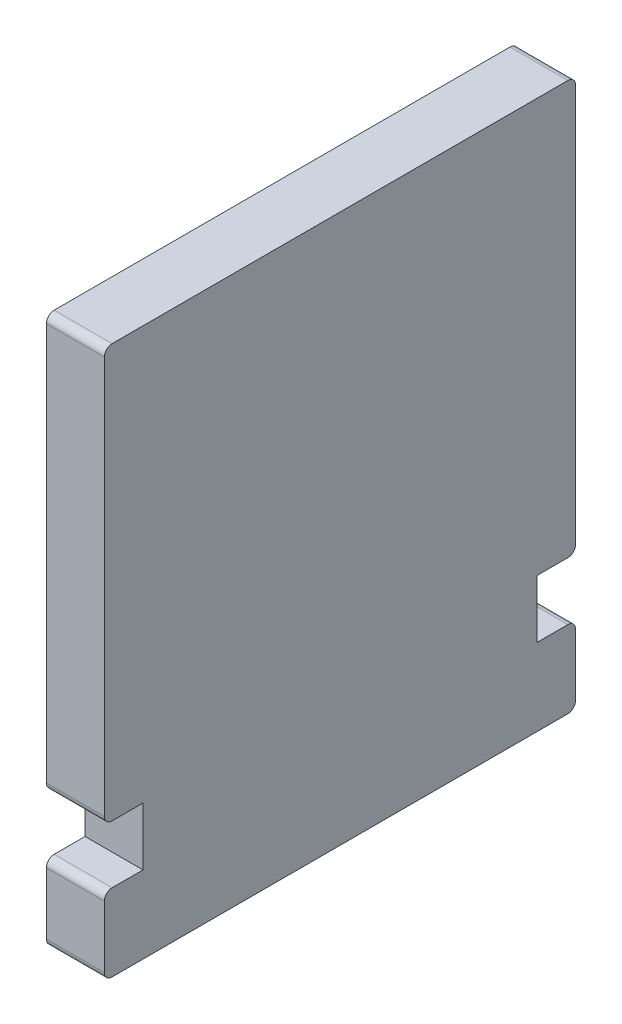
from build123d import *

# Parameters (mm, degrees)
SKETCH_1_W          = 1.5
SKETCH_1_H          = 14.2
EXTRUDE_1_DEPTH     = 12.2
CUT_EXTRUDE_2_REACH = 20.781
SKETCH_5_W          = 2.597491907
SKETCH_5_H          = 1.5
SKETCH_5_W_2        = 2.655260115
FILLET_1_R          = 0.2


with BuildPart() as part:
    # 草图1 → 凸台-拉伸1 (new body)
    with BuildSketch(Plane.XY):
        with Locations((0.75, 7.1)):
            Rectangle(SKETCH_1_W, SKETCH_1_H)
    extrude(amount=EXTRUDE_1_DEPTH)

    # 草图5 → 切除-拉伸2 (cut, up to next)
    with BuildSketch(Plane(origin=(1.5, 0, 0), x_dir=(0, 0, -1), z_dir=(1, 0, 0)), mode=Mode.PRIVATE) as cut_extrude_2_sk1:
        with Locations((-12.498745954, 2.75)):
            Rectangle(SKETCH_5_W, SKETCH_5_H)
    cut_extrude_2_tool1 = extrude(cut_extrude_2_sk1.sketch, amount=-CUT_EXTRUDE_2_REACH, mode=Mode.PRIVATE) & part.part
    # 草图5 → 切除-拉伸2 (cut, up to next)
    with BuildSketch(Plane(origin=(1.5, 0, 0), x_dir=(0, 0, -1), z_dir=(1, 0, 0)), mode=Mode.PRIVATE) as cut_extrude_2_sk2:
        with Locations((0.327630058, 2.75)):
            Rectangle(SKETCH_5_W_2, SKETCH_5_H)
    cut_extrude_2_tool2 = extrude(cut_extrude_2_sk2.sketch, amount=-CUT_EXTRUDE_2_REACH, mode=Mode.PRIVATE) & part.part
    add(cut_extrude_2_tool1.solids().sort_by_distance((1.5, 2.75, 12.498746))[0], mode=Mode.SUBTRACT)
    add(cut_extrude_2_tool2.solids().sort_by_distance((1.5, 2.75, -0.32763))[0], mode=Mode.SUBTRACT)

    # 圆角1
    fillet_1_edges = [part.edges().sort_by_distance(p)[0] for p in [
        (0.75, 14.2, 12.2),
        (0.75, 3.5, 12.2),
        (0.75, 2, 12.2),
        (0.75, 3.5, 0),
        (0.75, 2, 0),
        (0.75, 14.2, 0),
        (0.75, 0, 0),
        (0.75, 0, 12.2),
    ]]
    fillet(fillet_1_edges, radius=FILLET_1_R)


solid = part.part
